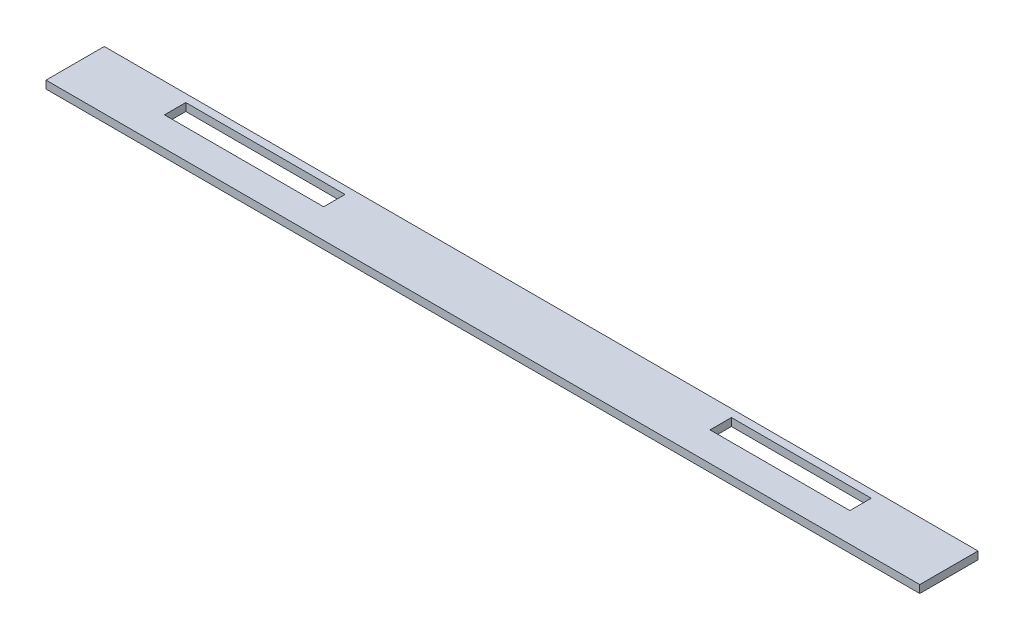
from build123d import *

# Parameters (mm, degrees)
SKETCH_1_W          = 450
SKETCH_1_H          = 30
EXTRUDE_1_DEPTH     = 4
SKETCH_2_W          = 82
SKETCH_2_H          = 11
SKETCH_2_W_2        = 72
CUT_EXTRUDE_1_DEPTH = 452.016629405


with BuildPart() as part:
    # 草圖1 → 填料-伸長1 (new body)
    with BuildSketch(Plane(origin=(0, 0, 0), x_dir=(1, 0, 0), z_dir=(0, 1, 0))):
        with Locations((225, 15)):
            Rectangle(SKETCH_1_W, SKETCH_1_H)
    extrude(amount=EXTRUDE_1_DEPTH)

    # 草圖2 → 除料-伸長1 (cut, through all)
    with BuildSketch(Plane(origin=(0, 4, 0), x_dir=(1, 0, 0), z_dir=(0, 1, 0))):
        with Locations((87, 20.5)):
            Rectangle(SKETCH_2_W, SKETCH_2_H)
        with Locations((363, 20.5)):
            Rectangle(SKETCH_2_W_2, SKETCH_2_H)
    extrude(amount=-CUT_EXTRUDE_1_DEPTH, mode=Mode.SUBTRACT)


solid = part.part
